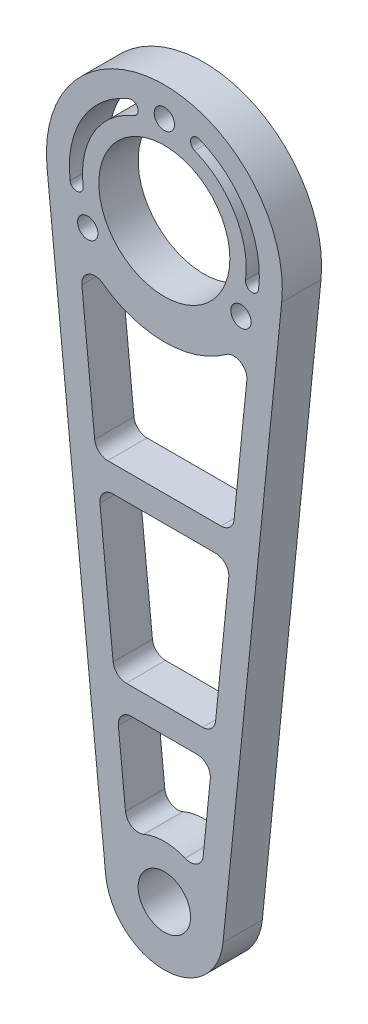
from build123d import *

# Parameters (mm, degrees)
SKETCH_1_R          = 4
SKETCH_1_R_2        = 1.55
SKETCH_1_R_3        = 10
EXTRUDE_1_DEPTH     = 6
CUT_EXTRUDE_1_DEPTH = 6
EXTRUDE_2_DEPTH     = 6
FILLET_1_R          = 2
CUT_EXTRUDE_2_DEPTH = 10


with BuildPart() as part:
    # 草图1 → 凸台-拉伸1 (new body)
    with BuildSketch(Plane.XY):
        with BuildLine():
            ThreePointArc((17.909773868, -1.8), (0, 18), (-17.909773868, -1.8))
            Line((-17.909773868, -1.8), (-8.954886934, -90.9))
            ThreePointArc((-8.954886934, -90.9), (0, -99), (8.954886934, -90.9))
            Line((8.954886934, -90.9), (17.909773868, -1.8))
        make_face()
        with Locations((0, -90)):
            Circle(SKETCH_1_R, mode=Mode.SUBTRACT)
        with Locations((-11.691342951, -6.75)):
            Circle(SKETCH_1_R_2, mode=Mode.SUBTRACT)
        with Locations((11.691342951, -6.75)):
            Circle(SKETCH_1_R_2, mode=Mode.SUBTRACT)
        Circle(SKETCH_1_R_3, mode=Mode.SUBTRACT)
        with Locations((0, 13.5)):
            Circle(SKETCH_1_R_2, mode=Mode.SUBTRACT)
    extrude(amount=EXTRUDE_1_DEPTH)

    # 草图2 → 切除-拉伸1 (cut)
    with BuildSketch(Plane.XY.offset(6)):
        with BuildLine():
            ThreePointArc((13.15522745, -9.107139547), (7.425825451, -14.172406866), (0, -16))
            Line((0, -16), (0, -82))
            ThreePointArc((0, -82), (3.024106775, -82.593598835), (5.599436985, -84.286305447))
            Line((5.599436985, -84.286305447), (13.15522745, -9.107139547))
        make_face()
        with BuildLine():
            ThreePointArc((0, -16), (-7.425825451, -14.172406866), (-13.15522745, -9.107139547))
            Line((-13.15522745, -9.107139547), (-5.599436985, -84.286305447))
            ThreePointArc((-5.599436985, -84.286305447), (-3.024106775, -82.593598835), (0, -82))
            Line((0, -82), (0, -16))
        make_face()
    extrude(amount=-CUT_EXTRUDE_1_DEPTH, mode=Mode.SUBTRACT)

    # 草图3 → 凸台-拉伸2 (add)
    with BuildSketch(Plane.XY.offset(6)):
        Polygon((10.251385716, -38), (-10.251385716, -38), (-10.050378153, -40), (10.050378153, -40), align=None)
        Polygon((-10.452393279, -36), (-10.251385716, -38), (10.251385716, -38), (10.452393279, -36), align=None)
        Polygon((7.437279833, -66), (-7.437279833, -66), (-7.23627227, -68), (7.23627227, -68), align=None)
        Polygon((7.638287396, -64), (-7.638287396, -64), (-7.437279833, -66), (7.437279833, -66), align=None)
    extrude(amount=-EXTRUDE_2_DEPTH)

    # 圆角1
    fillet_1_edges = [part.edges().sort_by_distance(p)[0] for p in [
        (-13.15522745, -9.107139547, 3),
        (13.15522745, -9.107139547, 3),
        (5.599436985, -84.286305447, 3),
        (-5.599436985, -84.286305447, 3),
        (-10.050378153, -40, 3),
        (-10.452393279, -36, 3),
        (10.452393279, -36, 3),
        (10.050378153, -40, 3),
        (-7.23627227, -68, 3),
        (-7.638287396, -64, 3),
        (7.638287396, -64, 3),
        (7.23627227, -68, 3),
    ]]
    fillet(fillet_1_edges, radius=FILLET_1_R)

    # 草图4 → 切除-拉伸2 (cut)
    with BuildSketch(Plane.XY.offset(6)):
        with BuildLine():
            ThreePointArc((-4.62962963, 11.611052041), (-4.071115837, 12.910306574), (-5.37037037, 13.468820367))
            ThreePointArc((-5.37037037, 13.468820367), (-12.505593382, 7.338946393), (-14.377656014, -1.87962963))
            ThreePointArc((-14.377656014, -1.87962963), (-13.256463901, -2.741562484), (-12.394531047, -1.62037037))
            ThreePointArc((-12.394531047, -1.62037037), (-10.78068395, 6.326677925), (-4.62962963, 11.611052041))
        make_face()
        with BuildLine():
            ThreePointArc((5.37037037, 13.468820367), (12.505593382, 7.338946393), (14.377656014, -1.87962963))
            ThreePointArc((14.377656014, -1.87962963), (13.256463901, -2.741562484), (12.394531047, -1.62037037))
            ThreePointArc((12.394531047, -1.62037037), (10.78068395, 6.326677925), (4.62962963, 11.611052041))
            ThreePointArc((4.62962963, 11.611052041), (4.071115837, 12.910306574), (5.37037037, 13.468820367))
        make_face()
    extrude(amount=-CUT_EXTRUDE_2_DEPTH, mode=Mode.SUBTRACT)


solid = part.part
